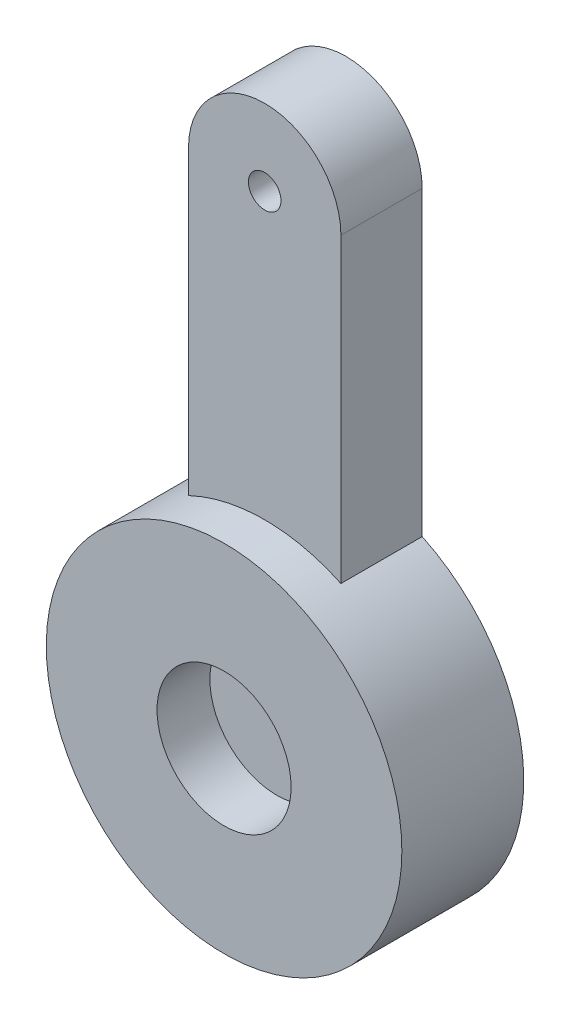
from build123d import *

# Parameters (mm, degrees)
CROQUIS1_R                 = 17.5
SALIENTE_EXTRUIR1_DEPTH    = 12
CROQUIS2_W                 = 15
CROQUIS2_H                 = 8
SALIENTE_EXTRUIR2_DEPTH    = 38
CROQUIS3_W                 = 15
CROQUIS3_H                 = 8
SALIENTE_EXTRUIR3_DEPTH    = 15
REDONDEO1_RADIUS           = 7.5
REDONDEO1_LENGTH           = 8
CROQUIS4_R                 = 6.6
CORTAR_EXTRUIR1_DEPTH      = 5.2
CORTAR_EXTRUIR2_START      = -5.2
CROQUIS5_R                 = 6.6
CORTAR_EXTRUIR2_DEPTH      = 5.2
CROQUIS7_R                 = 5
SALIENTE_EXTRUIR4_DEPTH    = 1.5
CORTAR_EXTRUIR3_DEPTH      = 58.089841478
CORTAR_EXTRUIR3_DEPTH_BACK = 58.089841478
CROQUIS6_R                 = 1.6


with BuildPart() as part:
    # Croquis1 → Saliente-Extruir1 (new body)
    with BuildSketch(Plane.XY):
        Circle(CROQUIS1_R)
    extrude(amount=SALIENTE_EXTRUIR1_DEPTH)

    # Croquis2 → Saliente-Extruir2 (add)
    with BuildSketch(Plane(origin=(0, 0, 0), x_dir=(1, 0, 0), z_dir=(0, 1, 0))):
        with Locations((0, -4)):
            Rectangle(CROQUIS2_W, CROQUIS2_H)
    extrude(amount=SALIENTE_EXTRUIR2_DEPTH)

    # Croquis3 → Saliente-Extruir3 (add)
    with BuildSketch(Plane(origin=(0, 38, 0), x_dir=(1, 0, 0), z_dir=(0, 1, 0))):
        with Locations((0, -4)):
            Rectangle(CROQUIS3_W, CROQUIS3_H)
    extrude(amount=SALIENTE_EXTRUIR3_DEPTH)

    # Redondeo1: full round fillet: the end face becomes a half cylinder, R = half its width
    redondeo1_face = Plane((0, 53, 4), x_dir=(0, 0, 1), z_dir=(0, 1, 0))  # on the end face: x along it, z out of the body
    redondeo1_slab = redondeo1_face.offset(-REDONDEO1_RADIUS / 2) * Box(REDONDEO1_LENGTH, 2 * REDONDEO1_RADIUS, REDONDEO1_RADIUS, mode=Mode.PRIVATE)  # the body's end, R deep
    redondeo1_round = Plane((0, 45.5, 4), x_dir=(0, 1, 0), z_dir=(0, 0, 1)) * Cylinder(REDONDEO1_RADIUS, REDONDEO1_LENGTH, mode=Mode.PRIVATE)  # its axis R under the face
    add(redondeo1_slab - redondeo1_round, mode=Mode.SUBTRACT)

    # Croquis4 → Cortar-Extruir1 (cut)
    with BuildSketch(Plane.XY.offset(12)):
        Circle(CROQUIS4_R)
    extrude(amount=-CORTAR_EXTRUIR1_DEPTH, mode=Mode.SUBTRACT)

    # Croquis5 → Cortar-Extruir2 (cut)
    with BuildSketch(Plane(origin=(0, 0, 0), x_dir=(-1, 0, 0), z_dir=(0, 0, -1)).offset(CORTAR_EXTRUIR2_START)):
        with Locations(Location((0, 0, 0), (0, 0, 180))):
            Circle(CROQUIS5_R)
    extrude(amount=CORTAR_EXTRUIR2_DEPTH, mode=Mode.SUBTRACT)

    # Croquis7 → Saliente-Extruir4 (add)
    with BuildSketch(Plane(origin=(0, 0, 0), x_dir=(-1, 0, 0), z_dir=(0, 0, -1))):
        with Locations(Location((0, 45.5, 0), (0, 0, 180))):
            Circle(CROQUIS7_R)
    extrude(amount=SALIENTE_EXTRUIR4_DEPTH)

    # Croquis6 → Cortar-Extruir3 (cut, two sides: drawn at the far end of the back side and taken through both)
    with BuildSketch(Plane(origin=(0, 0, 0), x_dir=(-1, 0, 0), z_dir=(0, 0, -1)).offset(-CORTAR_EXTRUIR3_DEPTH_BACK)):
        with Locations((0, 45.5)):
            Circle(CROQUIS6_R)
    extrude(amount=CORTAR_EXTRUIR3_DEPTH + CORTAR_EXTRUIR3_DEPTH_BACK, mode=Mode.SUBTRACT)


solid = part.part
